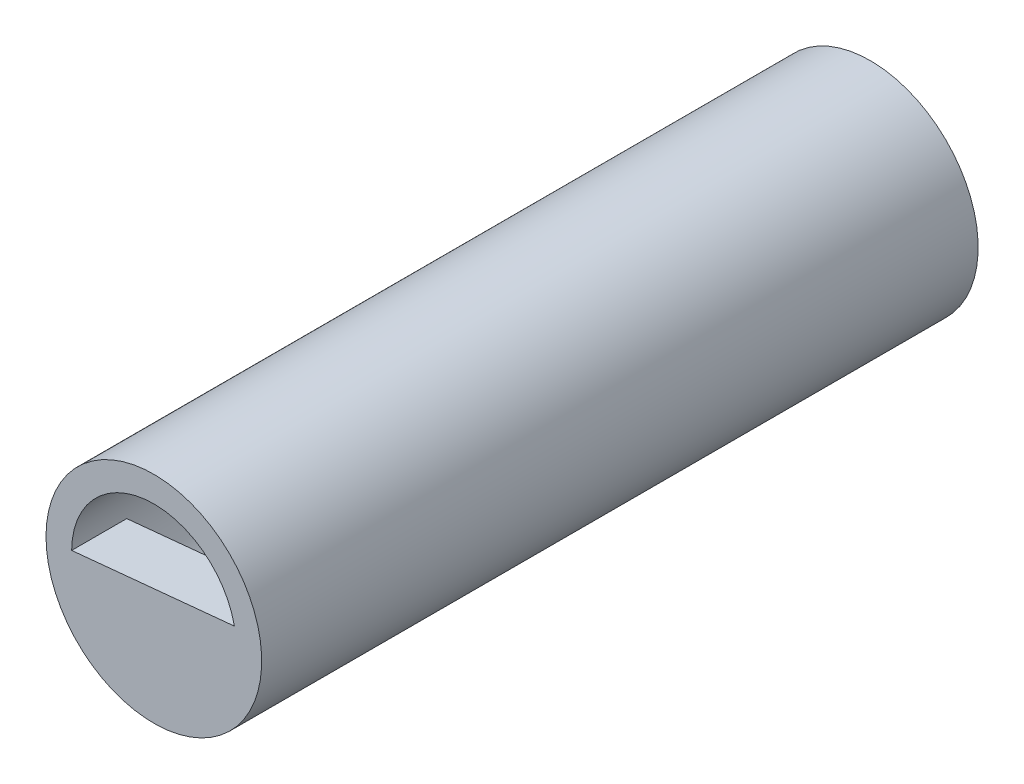
from build123d import *

# Parameters (mm, degrees)
SKETCH1_R           = 49.704747918
SKETCH1_R_2         = 37.896378772
BOSS_EXTRUDE1_DEPTH = 304.8
BOSS_EXTRUDE2_START = 25.4
SKETCH2_R           = 49.704747918
BOSS_EXTRUDE2_DEPTH = 25.4
BOSS_EXTRUDE3_START = -25.4
BOSS_EXTRUDE3_DEPTH = 25.4


with BuildPart() as part:
    # Sketch1 → Boss-Extrude1 (new body)
    with BuildSketch(Plane.XY):
        with Locations(Location((0, 0, 0), (0, 0, 180))):
            Circle(SKETCH1_R)
        with Locations(Location((0, 0, 0), (0, 0, 180))):
            Circle(SKETCH1_R_2, mode=Mode.SUBTRACT)
    extrude(amount=BOSS_EXTRUDE1_DEPTH)

    # Sketch2 → Boss-Extrude2 (add)
    with BuildSketch(Plane(origin=(0, 0, 0), x_dir=(-1, 0, 0), z_dir=(0, 0, -1)).offset(BOSS_EXTRUDE2_START)):
        Circle(SKETCH2_R)
    extrude(amount=-BOSS_EXTRUDE2_DEPTH)

    # Sketch3 → Boss-Extrude3 (add)
    with BuildSketch(Plane.XY.offset(304.8).offset(BOSS_EXTRUDE3_START)):
        with BuildLine():
            ThreePointArc((37.896378772, 0), (37.700998174, 3.843209698), (37.116871006, 7.64679088))
            Line((37.116871006, 7.64679088), (-37.894810184, 0.344797316))
            ThreePointArc((-37.894810184, 0.344797316), (-0.172400442, -37.895986623), (37.896378772, 0))
        make_face()
    extrude(amount=BOSS_EXTRUDE3_DEPTH)


solid = part.part
